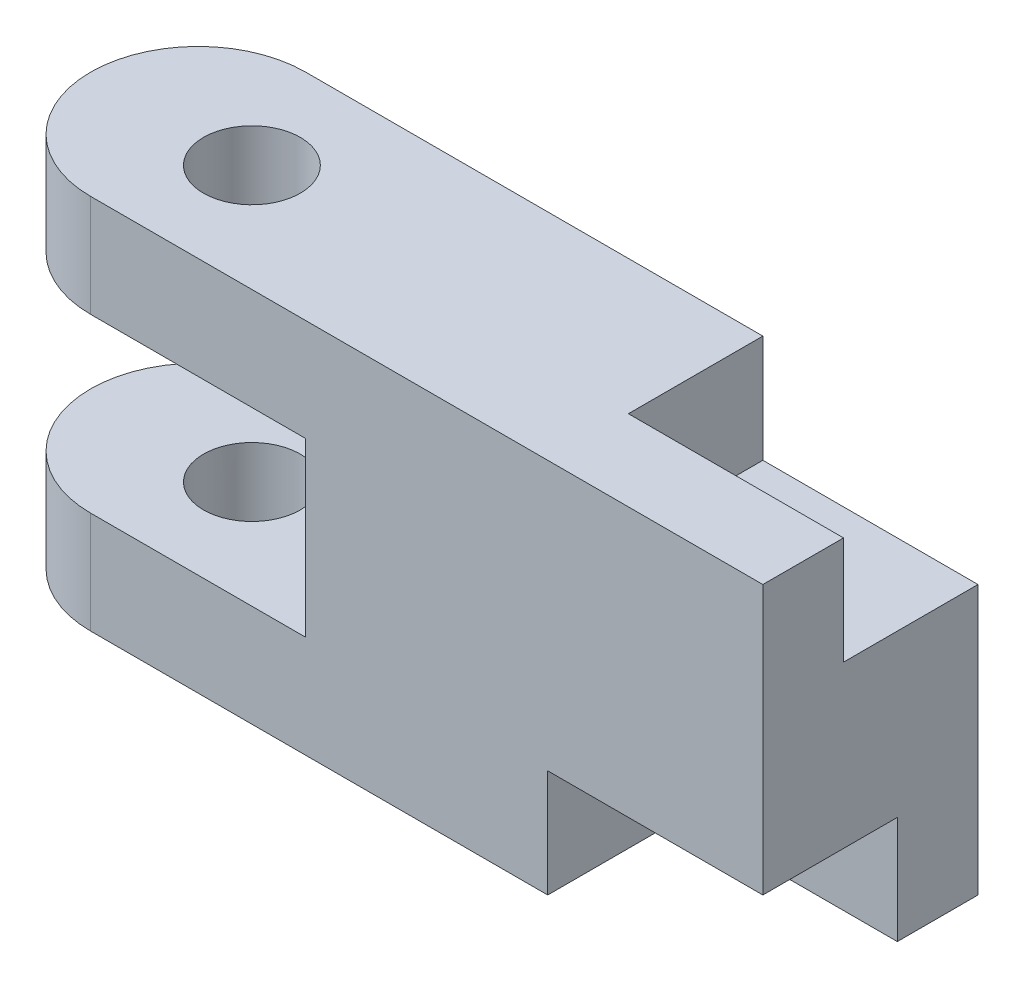
from build123d import *

# Parameters (mm, degrees)
SKETCH1_R           = 0.9
BOSS_EXTRUDE1_DEPTH = 7
CUT_EXTRUDE1_REACH  = 16.045
SKETCH2_W           = 6
SKETCH2_H           = 3.2
SKETCH3_W           = 2.5
SKETCH3_H           = 2
CUT_EXTRUDE2_DEPTH  = 4


with BuildPart() as part:
    # Sketch1 → Boss-Extrude1 (new body)
    with BuildSketch(Plane(origin=(0, 0, 0), x_dir=(1, 0, 0), z_dir=(0, 1, 0))):
        with BuildLine():
            Line((-1, 2), (11.5, 2))
            Line((11.5, 2), (11.5, -2))
            Line((11.5, -2), (-1, -2))
            ThreePointArc((-1, -2), (-3, 0), (-1, 2))
        make_face()
        with Locations(Location((0, 0, 0), (0, 0, 270))):
            Circle(SKETCH1_R, mode=Mode.SUBTRACT)
    extrude(amount=BOSS_EXTRUDE1_DEPTH)

    # Sketch2 → Cut-Extrude1 (cut, up to next)
    with BuildSketch(Plane.XY.offset(2), mode=Mode.PRIVATE) as cut_extrude1_sk1:
        with Locations((0, 3.5)):
            Rectangle(SKETCH2_W, SKETCH2_H)
    cut_extrude1_tool1 = extrude(cut_extrude1_sk1.sketch, amount=-CUT_EXTRUDE1_REACH, mode=Mode.PRIVATE) & part.part
    add(cut_extrude1_tool1.solids().sort_by_distance((0, 3.5, 2))[0], mode=Mode.SUBTRACT)

    # Sketch3 → Cut-Extrude2 (cut)
    with BuildSketch(Plane(origin=(11.5, 0, 0), x_dir=(0, 0, -1), z_dir=(1, 0, 0))):
        with Locations((0.75, 6)):
            Rectangle(SKETCH3_W, SKETCH3_H)
        with Locations((-0.75, 1)):
            Rectangle(SKETCH3_W, SKETCH3_H)
    extrude(amount=-CUT_EXTRUDE2_DEPTH, mode=Mode.SUBTRACT)


solid = part.part
